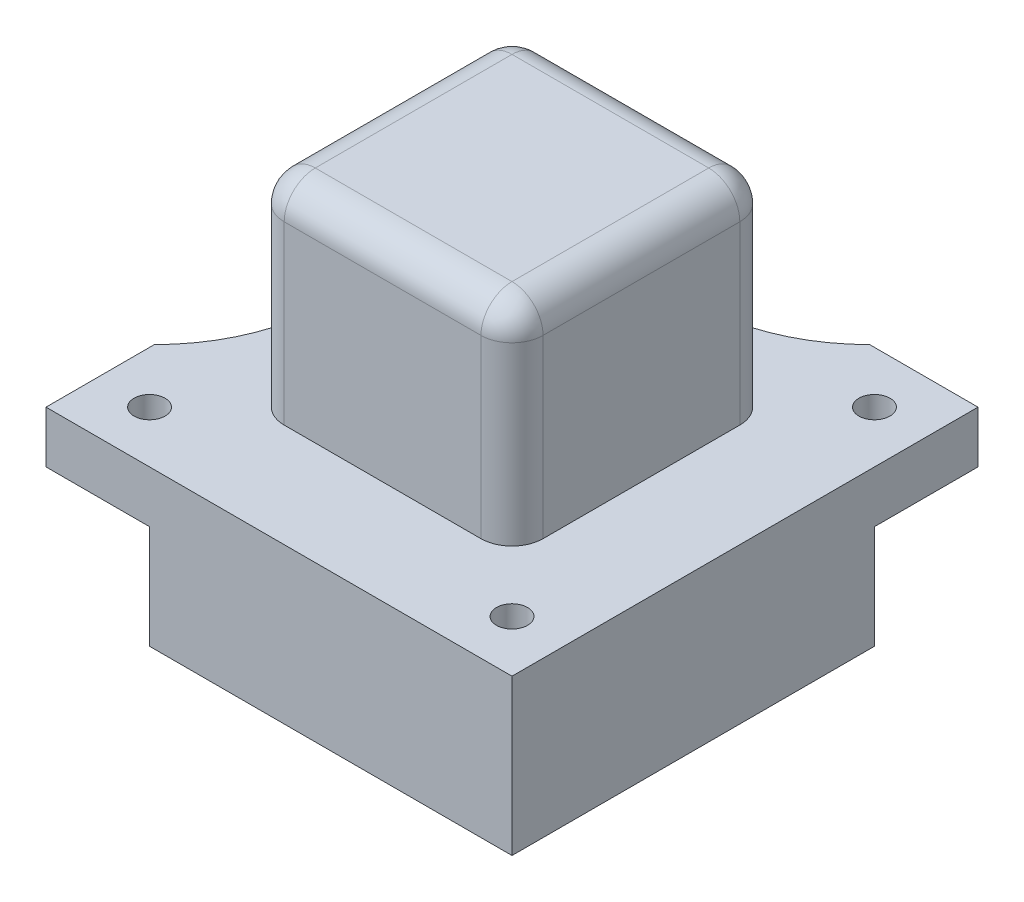
from build123d import *

# Parameters (mm, degrees)
SKETCH1_W               = 45
SKETCH1_H               = 45
BOSS_EXTRUDE1_DEPTH     = 15
CUT_EXTRUDE1_DEPTH      = 10
CUT_EXTRUDE2_DEPTH      = 38.243644172
CUT_EXTRUDE2_DEPTH_BACK = 38.243644172
SKETCH5_W               = 25
SKETCH5_H               = 25
BOSS_EXTRUDE2_DEPTH     = 20
FILLET1_R               = 3
SKETCH6_R               = 6
CUT_EXTRUDE4_DEPTH      = 28.99918
SKETCH7_W               = 13
SKETCH7_H               = 13
CUT_EXTRUDE5_DEPTH      = 13
FILLET2_R               = 3
CUT_EXTRUDE6_DEPTH      = 42.074189356
CUT_EXTRUDE6_DEPTH_BACK = 42.074189356
SKETCH8_R               = 1.5
SKETCH9_W               = 10.3
SKETCH9_H               = 10.3
CUT_EXTRUDE7_DEPTH      = 2.7
SKETCH10_R              = 6.85
BOSS_EXTRUDE3_DEPTH     = 2.3
CUT_EXTRUDE8_DEPTH      = 46.142818825
CUT_EXTRUDE9_DEPTH      = 46.142818825
CUT_EXTRUDE9_DEPTH_BACK = 46.142818825
SKETCH12_R              = 1.5


with BuildPart() as part:
    # Sketch1 → Boss-Extrude1 (new body)
    with BuildSketch(Plane(origin=(0, 0, 0), x_dir=(1, 0, 0), z_dir=(0, 1, 0))):
        with Locations((0.699698795, 4.865361446)):
            Rectangle(SKETCH1_W, SKETCH1_H)
    extrude(amount=BOSS_EXTRUDE1_DEPTH)

    # Sketch2 → Cut-Extrude1 (cut)
    with BuildSketch(Plane.XZ):
        Polygon((-21.800301205, 17.634638554), (-11.800301205, 17.634638554), (-11.800301205, -17.365361446), (23.199698795, -17.365361446), (23.199698795, -27.365361446), (-21.800301205, -27.365361446), align=None)
    extrude(amount=-CUT_EXTRUDE1_DEPTH, mode=Mode.SUBTRACT)

    # Sketch3 → Cut-Extrude2 (cut, two sides: drawn at the far end of the back side and taken through both)
    with BuildSketch(Plane.XZ.offset(-10).offset(-CUT_EXTRUDE2_DEPTH_BACK)):
        with BuildLine():
            Line((-11.340301205, -27.365361446), (12.739698795, -27.365361446))
            ThreePointArc((12.739698795, -27.365361446), (0.699698795, -22.366961339), (-11.340301205, -27.365361446))
        make_face()
        with BuildLine():
            Line((-21.800301205, 7.174638554), (-21.800301205, -16.905361446))
            ThreePointArc((-21.800301205, -16.905361446), (-16.801901098, -4.865361446), (-21.800301205, 7.174638554))
        make_face()
    extrude(amount=CUT_EXTRUDE2_DEPTH + CUT_EXTRUDE2_DEPTH_BACK, mode=Mode.SUBTRACT)

    # Sketch5 → Boss-Extrude2 (add)
    with BuildSketch(Plane(origin=(0, 15, 0), x_dir=(1, 0, 0), z_dir=(0, 1, 0))):
        with Locations((0.699698795, 4.865361446)):
            Rectangle(SKETCH5_W, SKETCH5_H)
    extrude(amount=BOSS_EXTRUDE2_DEPTH)

    # Fillet1
    fillet1_edges = [part.edges().sort_by_distance(p)[0] for p in [
        (-11.800301205, 25, -17.365361446),
        (-11.800301205, 25, 7.634638554),
        (13.199698795, 25, 7.634638554),
        (13.199698795, 25, -17.365361446),
        (-11.800301205, 35, -4.865361446),
        (0.699698795, 35, 7.634638554),
        (13.199698795, 35, -4.865361446),
        (0.699698795, 35, -17.365361446),
    ]]
    fillet(fillet1_edges, radius=FILLET1_R)

    # Sketch6 → Cut-Extrude4 (cut)
    with BuildSketch(Plane(origin=(0, 0, 0), x_dir=(-1, 0, 0), z_dir=(0, -1, 0))):
        with Locations(Location((-0.699698795, 4.865361446, 0), (0, 0, 90))):
            Circle(SKETCH6_R)
    extrude(amount=-CUT_EXTRUDE4_DEPTH, mode=Mode.SUBTRACT)

    # Sketch7 → Cut-Extrude5 (cut)
    with BuildSketch(Plane.XZ.offset(-28.99918)):
        with Locations((0.699698795, -4.865361446)):
            Rectangle(SKETCH7_W, SKETCH7_H)
    extrude(amount=CUT_EXTRUDE5_DEPTH, mode=Mode.SUBTRACT)

    # Fillet2
    fillet2_edges = [part.edges().sort_by_distance(p)[0] for p in [
        (-5.800301205, 28.99918, -4.865361446),
        (-5.800301205, 22.49918, 1.634638554),
        (0.699698795, 28.99918, -11.365361446),
        (-5.800301205, 22.49918, -11.365361446),
        (7.199698795, 28.99918, -4.865361446),
        (7.199698795, 22.49918, -11.365361446),
        (0.699698795, 28.99918, 1.634638554),
        (7.199698795, 22.49918, 1.634638554),
    ]]
    fillet(fillet2_edges, radius=FILLET2_R)

    # Sketch8 → Cut-Extrude6 (cut, two sides: drawn at the far end of the back side and taken through both)
    with BuildSketch(Plane(origin=(0, 15, 0), x_dir=(1, 0, 0), z_dir=(0, 1, 0)).offset(-CUT_EXTRUDE6_DEPTH_BACK)):
        with Locations(Location((-16.800301205, 22.365361446, 0), (0, 0, 270))):
            Circle(SKETCH8_R)
        with Locations(Location((18.199698795, 22.365361446, 0), (0, 0, 270))):
            Circle(SKETCH8_R)
        with Locations(Location((18.199698795, -12.634638554, 0), (0, 0, 270))):
            Circle(SKETCH8_R)
        with Locations(Location((-16.800301205, -12.634638554, 0), (0, 0, 270))):
            Circle(SKETCH8_R)
    extrude(amount=CUT_EXTRUDE6_DEPTH + CUT_EXTRUDE6_DEPTH_BACK, mode=Mode.SUBTRACT)

    # Sketch9 → Cut-Extrude7 (cut)
    with BuildSketch(Plane(origin=(0, 15, 0), x_dir=(1, 0, 0), z_dir=(0, 1, 0))):
        with Locations((-16.650301205, 22.215361446)):
            Rectangle(SKETCH9_W, SKETCH9_H)
    extrude(amount=-CUT_EXTRUDE7_DEPTH, mode=Mode.SUBTRACT)

    # Sketch10 → Boss-Extrude3 (add)
    with BuildSketch(Plane.XZ.offset(-10)):
        with Locations((-16.800301205, -22.365361446)):
            Circle(SKETCH10_R)
    extrude(amount=-BOSS_EXTRUDE3_DEPTH)

    # Sketch11 → Cut-Extrude8 (cut, through all)
    with BuildSketch(Plane.XZ.offset(-10)):
        with BuildLine():
            Line((-21.482448148, -27.365361446), (-21.800301205, -27.365361446))
            Line((-21.800301205, -27.365361446), (-21.800301205, -27.047508389))
            ThreePointArc((-21.800301205, -27.047508389), (-21.650197676, -27.215257917), (-21.482448148, -27.365361446))
        make_face()
    extrude(amount=-CUT_EXTRUDE8_DEPTH, mode=Mode.SUBTRACT)

    # Sketch12 → Cut-Extrude9 (cut, two sides: drawn at the far end of the back side and taken through both)
    with BuildSketch(Plane.XZ.offset(-10).offset(-CUT_EXTRUDE9_DEPTH_BACK)):
        with Locations(Location((-17.110205033, -22.675265274, 0), (0, 0, 90))):
            Circle(SKETCH12_R)
    extrude(amount=CUT_EXTRUDE9_DEPTH + CUT_EXTRUDE9_DEPTH_BACK, mode=Mode.SUBTRACT)


solid = part.part
